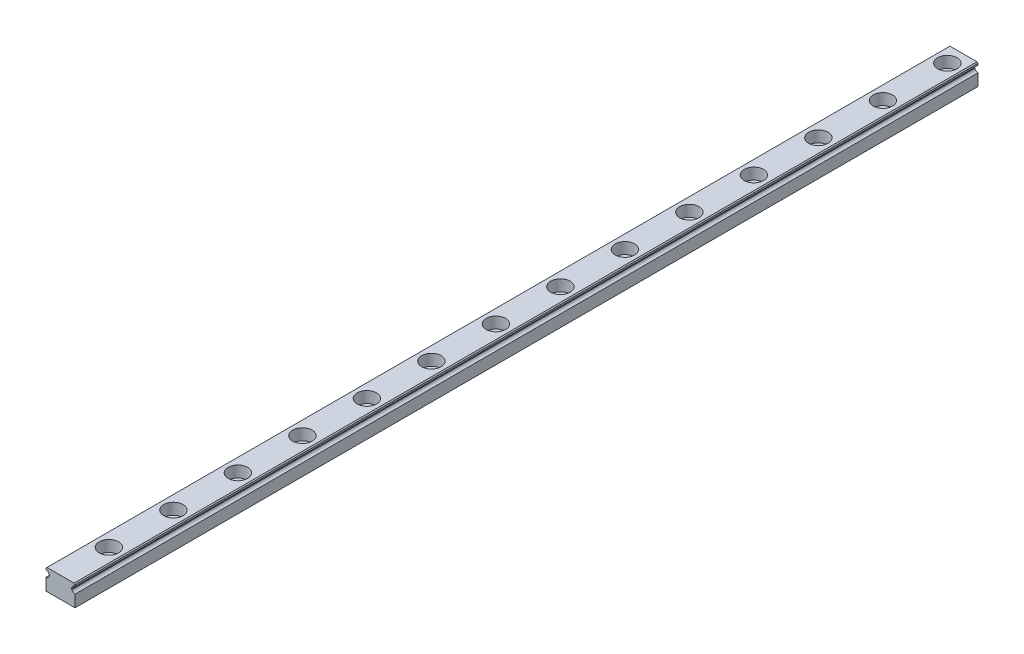
from build123d import *

# Parameters (mm, degrees)
EXTRUDE1_DEPTH  = 280
SKETCH2_R       = 3
EXTRUDE2_DEPTH  = 3.5
SKETCH_R        = 1.75
EXTRUDE3_DEPTH  = 281.111584909
LPATTERN1_COUNT = 40
LPATTERN1_PITCH = 20
CHAMFER1_SIZE   = 0.3


with BuildPart() as part:
    # Sketch1 → Extrude1 (new body)
    with BuildSketch(Plane.XY):
        with BuildLine():
            Line((-4.5, -3.25), (4.5, -3.25))
            Line((4.5, -3.25), (4.5, 0.45))
            ThreePointArc((4.5, 0.45), (3.887627564, 0.659430585), (3.531754163, 1.2))
            Line((3.531754163, 1.2), (3.4, 1.2))
            Line((3.4, 1.2), (3.4, 1.7))
            Line((3.4, 1.7), (3.531754163, 1.7))
            ThreePointArc((3.531754163, 1.7), (3.887627564, 2.240569415), (4.5, 2.45))
            Line((4.5, 2.45), (4.5, 3.25))
            Line((4.5, 3.25), (-4.5, 3.25))
            Line((-4.5, 3.25), (-4.5, 2.45))
            ThreePointArc((-4.5, 2.45), (-3.887627564, 2.240569415), (-3.531754163, 1.7))
            Line((-3.531754163, 1.7), (-3.4, 1.7))
            Line((-3.4, 1.7), (-3.4, 1.2))
            Line((-3.4, 1.2), (-3.531754163, 1.2))
            ThreePointArc((-3.531754163, 1.2), (-3.887627564, 0.659430585), (-4.5, 0.45))
            Line((-4.5, 0.45), (-4.5, -3.25))
        make_face()
    extrude(amount=EXTRUDE1_DEPTH)

    # Sketch2 → Extrude2 (cut)
    with BuildSketch(Plane(origin=(0, 3.25, 0), x_dir=(1, 0, 0), z_dir=(0, 1, 0))):
        with Locations((0, -5)):
            Circle(SKETCH2_R)
    extrude2 = extrude(amount=-EXTRUDE2_DEPTH, mode=Mode.SUBTRACT)

    # Sketch → Extrude3 (cut, through all)
    with BuildSketch(Plane(origin=(0, 3.25, 0), x_dir=(1, 0, 0), z_dir=(0, 1, 0))):
        with Locations((0, -5)):
            Circle(SKETCH_R)
    extrude3 = extrude(amount=-EXTRUDE3_DEPTH, mode=Mode.SUBTRACT)

    # LPattern1: Extrude2, Extrude3 ×40
    with Locations(*[(0, 0, i * LPATTERN1_PITCH) for i in range(1, LPATTERN1_COUNT)]):
        add(extrude2, mode=Mode.SUBTRACT)
        add(extrude3, mode=Mode.SUBTRACT)

    # Chamfer1
    chamfer1_edges = [part.edges().sort_by_distance(p)[0] for p in [
        (4.5, 3.25, 140),
        (-4.5, 3.25, 140),
    ]]
    chamfer(chamfer1_edges, length=CHAMFER1_SIZE)


solid = part.part
